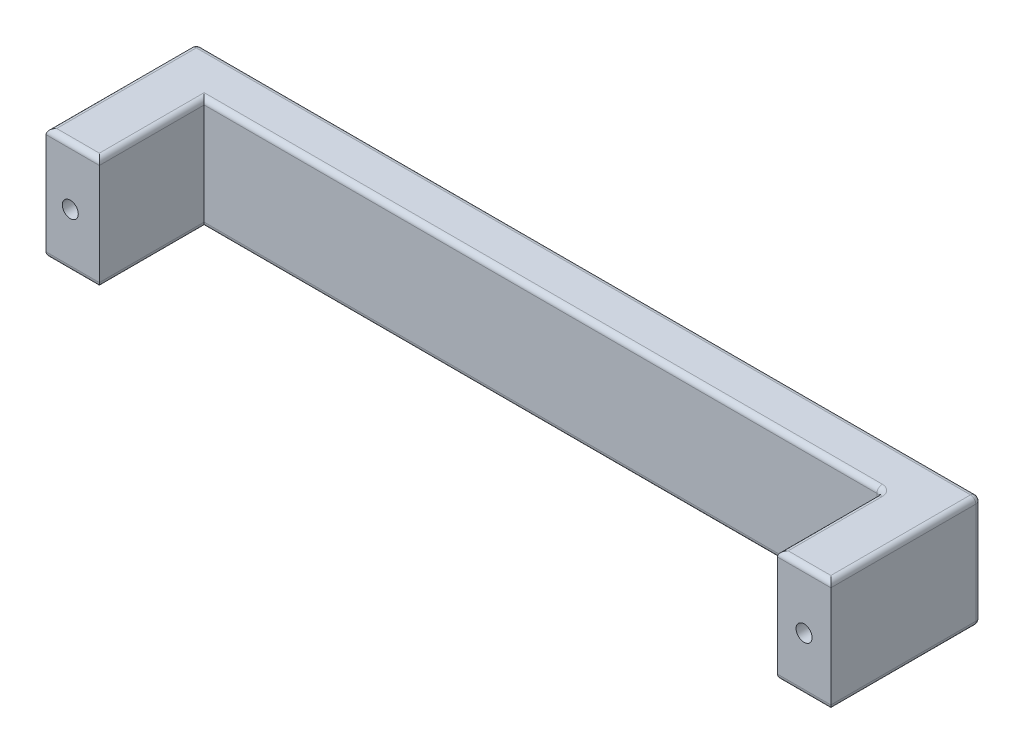
from build123d import *

# Parameters (mm, degrees)
SALIENTE_EXTRUIR1_DEPTH           = 21
REDONDEO1_R                       = 1
RANURAS_DE_ESPIGA_DE_3_0MM1_D     = 3
RANURAS_DE_ESPIGA_DE_3_0MM1_DEPTH = 15
RANURAS_DE_ESPIGA_DE_3_0MM1_TIP   = 0.901290929


with BuildPart() as part:
    # Croquis1 → Saliente-Extruir1 (new body)
    with BuildSketch(Plane(origin=(0, 0, 0), x_dir=(1, 0, 0), z_dir=(0, 1, 0))):
        Polygon((-45.555555556, 0), (-45.555555556, 28.148148148), (101.481481481, 28.148148148), (101.481481481, 0), (91.481481481, 0), (91.481481481, 19.62962963), (-35.555555556, 19.62962963), (-35.555555556, 0), align=None)
    extrude(amount=SALIENTE_EXTRUIR1_DEPTH)

    # Redondeo1
    redondeo1_edges = [part.edges().sort_by_distance(p)[0] for p in [
        (27.962962963, 21, -19.62962963),
        (-35.555555556, 0, -9.814814815),
        (-40.555555556, 0, 0),
        (91.481481481, 21, -9.814814815),
        (-45.555555556, 10.5, -28.148148148),
        (101.481481481, 10.5, -28.148148148),
        (91.481481481, 10.5, -19.62962963),
        (96.481481481, 21, 0),
        (101.481481481, 21, -14.074074074),
        (27.962962963, 21, -28.148148148),
        (-45.555555556, 21, -14.074074074),
        (-40.555555556, 21, 0),
        (-35.555555556, 21, -9.814814815),
        (-45.555555556, 0, -14.074074074),
        (27.962962963, 0, -28.148148148),
        (101.481481481, 0, -14.074074074),
        (96.481481481, 0, 0),
        (91.481481481, 0, -9.814814815),
        (27.962962963, 0, -19.62962963),
    ]]
    fillet(redondeo1_edges, radius=REDONDEO1_R)

    # Ranuras de espiga de Ø3.0mm1
    with Locations(Plane.XY):
        with Locations((-41.007352785, 10.144878608), (96.462672376, 10.144878608)):
            Hole(RANURAS_DE_ESPIGA_DE_3_0MM1_D / 2, depth=RANURAS_DE_ESPIGA_DE_3_0MM1_DEPTH)
            with Locations((0, 0, -(RANURAS_DE_ESPIGA_DE_3_0MM1_DEPTH + RANURAS_DE_ESPIGA_DE_3_0MM1_TIP / 2))):  # 118° drill point
                Cone(0, RANURAS_DE_ESPIGA_DE_3_0MM1_D / 2, RANURAS_DE_ESPIGA_DE_3_0MM1_TIP, mode=Mode.SUBTRACT)


solid = part.part
